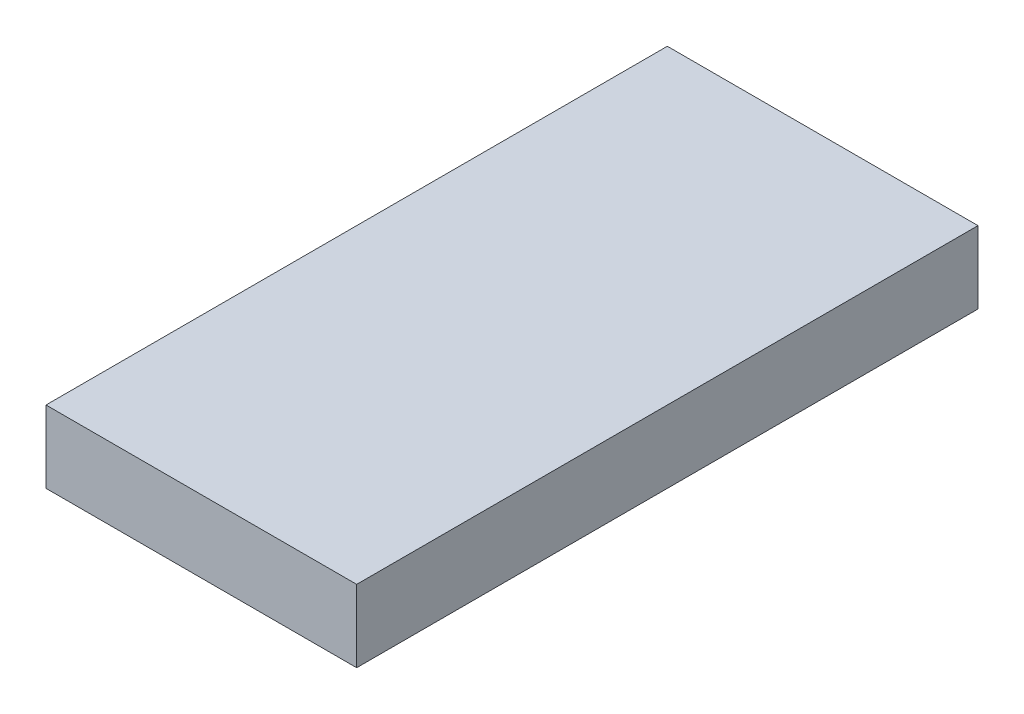
from build123d import *

# Parameters (mm, degrees)
BASE_SKETCH_W       = 50.8
BASE_SKETCH_H       = 101.6
BOSS_EXTRUDE1_DEPTH = 11.81


with BuildPart() as part:
    # Base_Sketch → Boss-Extrude1 (new body)
    with BuildSketch(Plane(origin=(0, 0, 0), x_dir=(1, 0, 0), z_dir=(0, 1, 0))):
        with Locations((-321.287161947, 565.300570036)):
            Rectangle(BASE_SKETCH_W, BASE_SKETCH_H)
    extrude(amount=BOSS_EXTRUDE1_DEPTH)


solid = part.part
